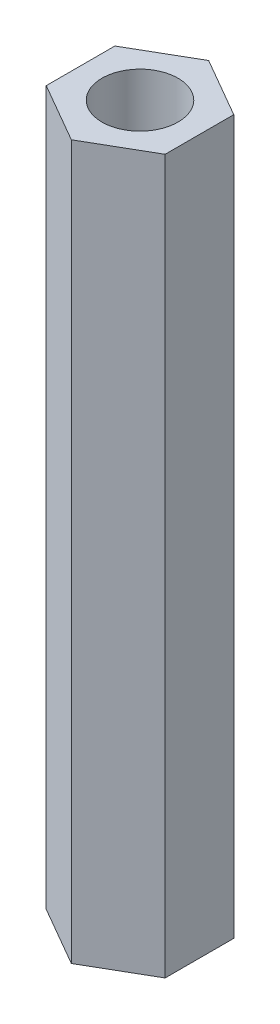
from build123d import *

# Parameters (mm, degrees)
SKETCH_1_R      = 1.6
EXTRUDE_1_DEPTH = 30


with BuildPart() as part:
    # 草图1 → 凸台-拉伸1 (new body)
    with BuildSketch(Plane(origin=(0, 0, 0), x_dir=(1, 0, 0), z_dir=(0, 1, 0))):
        Polygon((0, 2.886751346), (-2.5, 1.443375673), (-2.5, -1.443375673), (0, -2.886751346), (2.5, -1.443375673), (2.5, 1.443375673), align=None)
        with Locations(Location((0, 0, 0), (0, 0, 270))):
            Circle(SKETCH_1_R, mode=Mode.SUBTRACT)
    extrude(amount=EXTRUDE_1_DEPTH)


solid = part.part
